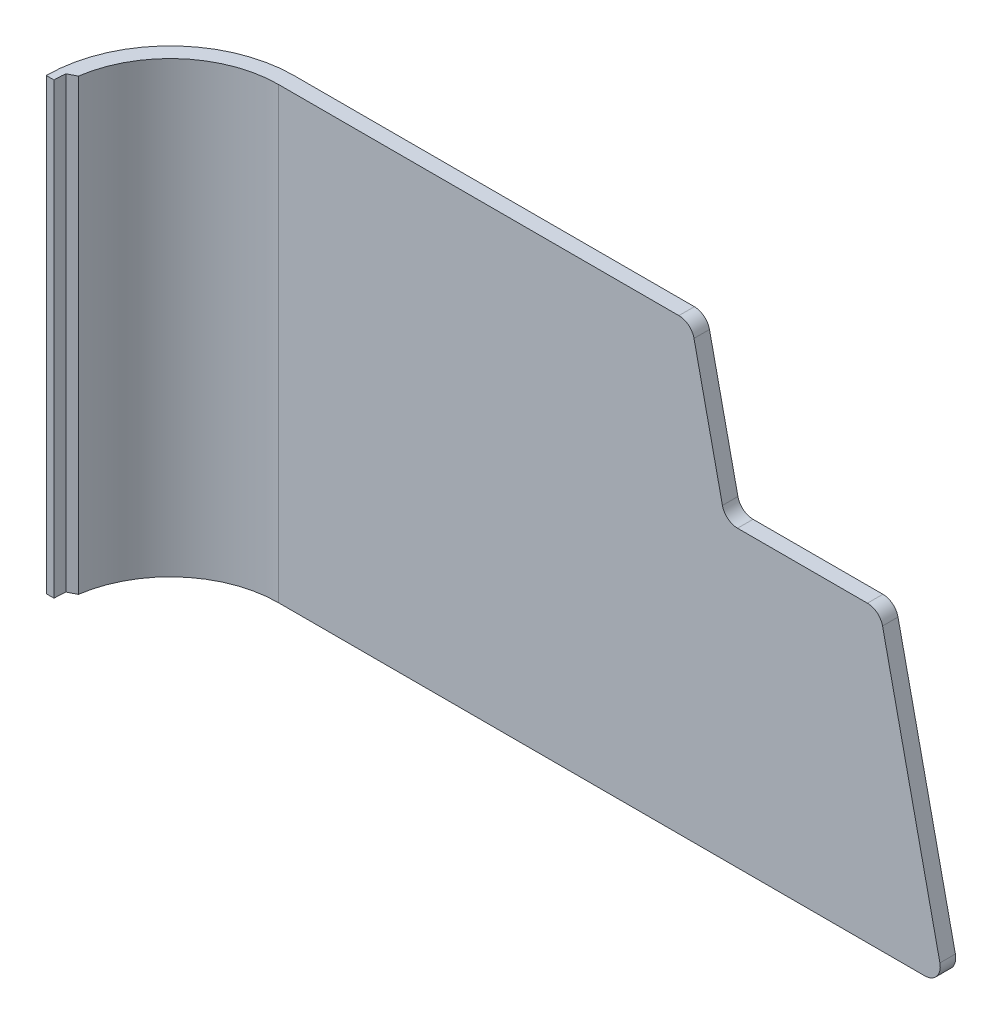
from build123d import *

# Parameters (mm, degrees)
BOSS_EXTRUDE1_DEPTH = 58
CUT_EXTRUDE2_DEPTH  = 2
FILLET1_R           = 2


with BuildPart() as part:
    # Sketch1 → Boss-Extrude1 (new body)
    with BuildSketch(Plane(origin=(0, 0, 0), x_dir=(1, 0, 0), z_dir=(0, 1, 0))):
        with BuildLine():
            Line((-50, 16), (36, 16))
            Line((36, 16), (36, 14))
            Line((36, 14), (-50, 14))
            ThreePointArc((-50, 14), (-59.16515139, 10.583005244), (-63.856406461, 2))
            Line((-63.856406461, 2), (-64.928657629, 1.461225992))
            ThreePointArc((-64.928657629, 1.461225992), (-64.982153791, 0.731483276), (-65, 0))
            Line((-65, 0), (-66, 0))
            ThreePointArc((-66, 0), (-61.313708499, 11.313708499), (-50, 16))
        make_face()
    extrude(amount=BOSS_EXTRUDE1_DEPTH)

    # Sketch2 → Cut-Extrude2 (cut)
    with BuildSketch(Plane.XY.offset(-14)):
        Polygon((36, 58), (12.87566783, 58), (3.353954895, 58), (7.714660104, 38), (27.714660104, 38), (36, 0), align=None)
    extrude(amount=-CUT_EXTRUDE2_DEPTH, mode=Mode.SUBTRACT)

    # Fillet1
    fillet1_edges = [part.edges().sort_by_distance(p)[0] for p in [
        (36, 0, -15),
        (7.714660104, 38, -15),
        (3.353954895, 58, -15),
        (27.714660104, 38, -15),
    ]]
    fillet(fillet1_edges, radius=FILLET1_R)


solid = part.part
